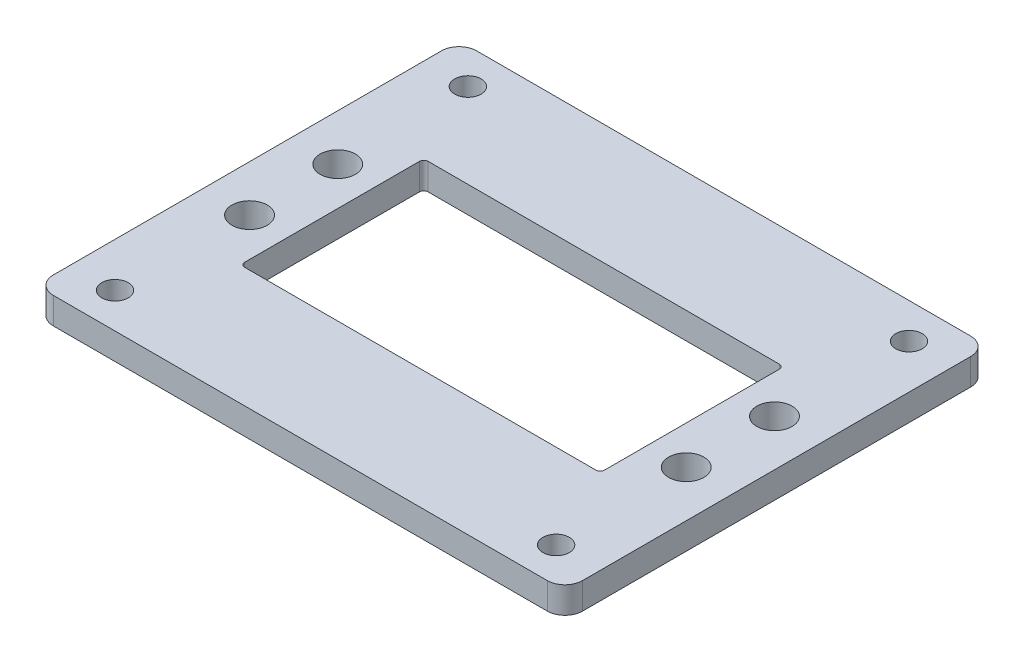
from build123d import *

# Parameters (mm, degrees)
SKETCH_1_W      = 60
SKETCH_1_H      = 48
SKETCH_1_R      = 2
SKETCH_1_R_2    = 1.5
SKETCH_1_W_2    = 40.8
SKETCH_1_H_2    = 20.8
EXTRUDE_1_DEPTH = 3
FILLET_1_R      = 0.5
FILLET_2_R      = 2


with BuildPart() as part:
    # 草图1 → 凸台-拉伸1 (new body)
    with BuildSketch(Plane(origin=(0, 0, 0), x_dir=(1, 0, 0), z_dir=(0, 1, 0))):
        Rectangle(SKETCH_1_W, SKETCH_1_H)
        with Locations(Location((24.75, 5, 0), (0, 0, 270))):
            Circle(SKETCH_1_R, mode=Mode.SUBTRACT)
        with Locations(Location((24.75, -5, 0), (0, 0, 90))):
            Circle(SKETCH_1_R, mode=Mode.SUBTRACT)
        with Locations(Location((-24.75, -5, 0), (0, 0, 270))):
            Circle(SKETCH_1_R, mode=Mode.SUBTRACT)
        with Locations(Location((-24.75, 5, 0), (0, 0, 90))):
            Circle(SKETCH_1_R, mode=Mode.SUBTRACT)
        with Locations(Location((-25, 20, 0), (0, 0, 270))):
            Circle(SKETCH_1_R_2, mode=Mode.SUBTRACT)
        with Locations(Location((25, 20, 0), (0, 0, 90))):
            Circle(SKETCH_1_R_2, mode=Mode.SUBTRACT)
        with Locations(Location((25, -20, 0), (0, 0, 270))):
            Circle(SKETCH_1_R_2, mode=Mode.SUBTRACT)
        with Locations(Location((-25, -20, 0), (0, 0, 90))):
            Circle(SKETCH_1_R_2, mode=Mode.SUBTRACT)
        Rectangle(SKETCH_1_W_2, SKETCH_1_H_2, mode=Mode.SUBTRACT)
    extrude(amount=EXTRUDE_1_DEPTH)

    # 圆角1
    fillet_1_edges = [part.edges().sort_by_distance(p)[0] for p in [
        (20.4, 1.5, 10.4),
        (20.4, 1.5, -10.4),
        (-20.4, 1.5, -10.4),
        (-20.4, 1.5, 10.4),
    ]]
    fillet(fillet_1_edges, radius=FILLET_1_R)

    # 圆角2
    fillet_2_edges = [part.edges().sort_by_distance(p)[0] for p in [
        (30, 1.5, 24),
        (-30, 1.5, 24),
        (-30, 1.5, -24),
        (30, 1.5, -24),
    ]]
    fillet(fillet_2_edges, radius=FILLET_2_R)


solid = part.part
